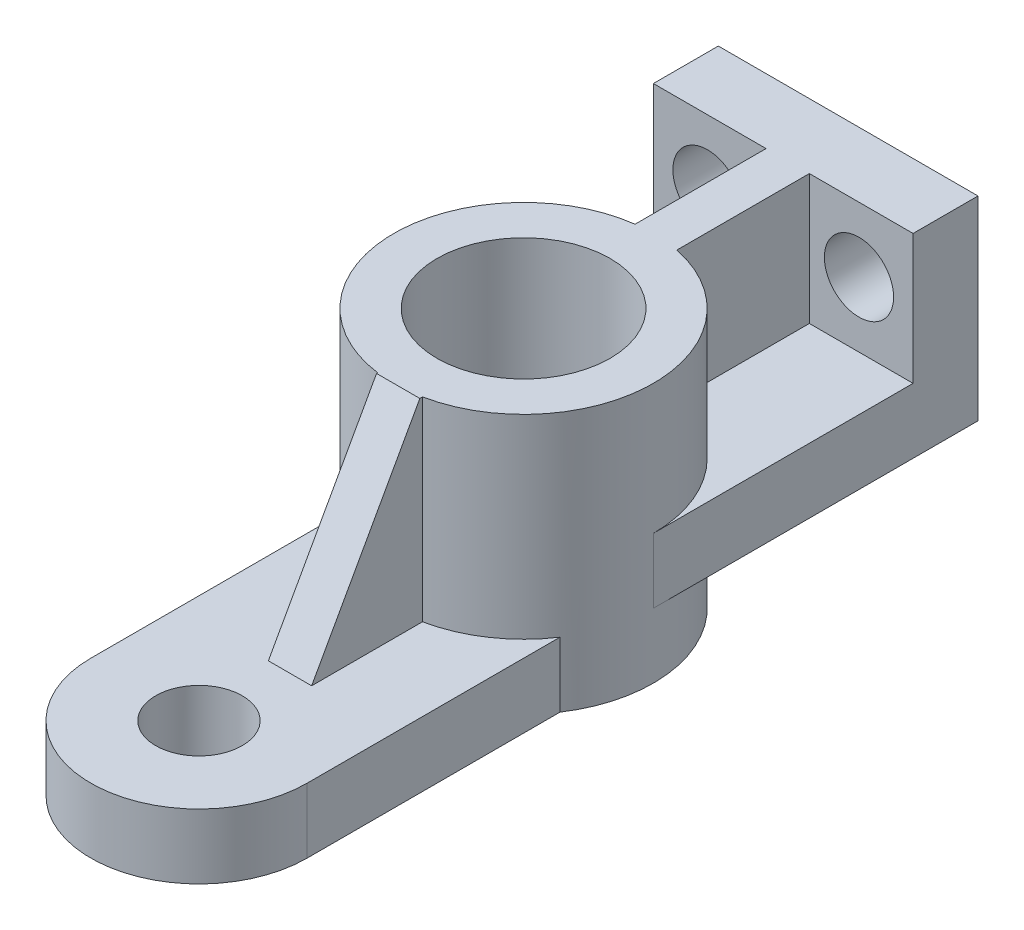
from build123d import *

# Parameters (mm, degrees)
SKETCH1_W               = 1524
SKETCH1_H               = 1143
BOSS_EXTRUDE1_DEPTH     = 381
SKETCH4_R               = 203.2
CUT_EXTRUDE1_DEPTH      = 1943.726434679
SKETCH5_R               = 762
BOSS_EXTRUDE2_DEPTH     = 1524
SKETCH6_W               = 1524
SKETCH6_H               = 381
BOSS_EXTRUDE3_DEPTH     = 1524
SKETCH8_W               = 254
SKETCH8_H               = 787.4
BOSS_EXTRUDE4_DEPTH     = 762
SKETCH10_W              = 1270
SKETCH10_H              = 381
BOSS_EXTRUDE5_DEPTH     = 1905
SKETCH11_R              = 635
BOSS_EXTRUDE6_DEPTH     = 381
CUT_EXTRUDE2_DEPTH      = 4837.015922224
CUT_EXTRUDE2_DEPTH_BACK = 4837.015922224
SKETCH12_R              = 254
BOSS_EXTRUDE10_DEPTH    = 254
SKETCH14_W              = 254
SKETCH14_H              = 1143
BOSS_EXTRUDE11_DEPTH    = 25.4
CUT_EXTRUDE3_DEPTH      = 4940.957186049
CUT_EXTRUDE3_DEPTH_BACK = 4940.957186049
SKETCH15_R              = 508


with BuildPart() as part:
    # Sketch1 → Boss-Extrude1 (new body)
    with BuildSketch(Plane.XY):
        with Locations((-762, 571.5)):
            Rectangle(SKETCH1_W, SKETCH1_H)
    extrude(amount=BOSS_EXTRUDE1_DEPTH)

    # Sketch4 → Cut-Extrude1 (cut, through all)
    with BuildSketch(Plane.XY.offset(381)):
        with Locations((-317.5, 762)):
            Circle(SKETCH4_R)
        with Locations((-1206.5, 762)):
            Circle(SKETCH4_R)
    extrude(amount=-CUT_EXTRUDE1_DEPTH, mode=Mode.SUBTRACT)



with BuildPart() as body_2:
    # Sketch5 → Boss-Extrude2 (new body)
    with BuildSketch(Plane(origin=(0, 1143, 0), x_dir=(1, 0, 0), z_dir=(0, 1, 0))):
        with Locations(Location((-762, -1905, 0), (0, 0, 180))):
            Circle(SKETCH5_R)
    extrude(amount=-BOSS_EXTRUDE2_DEPTH)


with BuildPart() as part_1:
    add(part.part)

    add(body_2.part)  # Boss-Extrude3 merges body 2
    # Sketch6 → Boss-Extrude3 (add)
    with BuildSketch(Plane.XY.offset(381)):
        with Locations((-762, 190.5)):
            Rectangle(SKETCH6_W, SKETCH6_H)
    extrude(amount=BOSS_EXTRUDE3_DEPTH)

    # Sketch8 → Boss-Extrude4 (add)
    with BuildSketch(Plane(origin=(0, 381, 0), x_dir=(1, 0, 0), z_dir=(0, 1, 0))):
        with Locations((-735.723112529, -774.7)):
            Rectangle(SKETCH8_W, SKETCH8_H)
    extrude(amount=BOSS_EXTRUDE4_DEPTH)

    # Sketch10 → Boss-Extrude5 (add)
    with BuildSketch(Plane.XY.offset(1905)):
        with Locations((-762, -190.5)):
            Rectangle(SKETCH10_W, SKETCH10_H)
    extrude(amount=BOSS_EXTRUDE5_DEPTH)

    # Sketch11 → Boss-Extrude6 (add)
    with BuildSketch(Plane(origin=(0, 0, 0), x_dir=(1, 0, 0), z_dir=(0, 1, 0))):
        with Locations((-762, -3810)):
            Circle(SKETCH11_R)
    extrude(amount=-BOSS_EXTRUDE6_DEPTH)

    # Sketch12 → Cut-Extrude2 (cut, two sides: drawn at the far end of the back side and taken through both)
    with BuildSketch(Plane(origin=(0, 0, 0), x_dir=(1, 0, 0), z_dir=(0, 1, 0)).offset(-CUT_EXTRUDE2_DEPTH_BACK)):
        with Locations((-762, -3810)):
            Circle(SKETCH12_R)
    extrude(amount=CUT_EXTRUDE2_DEPTH + CUT_EXTRUDE2_DEPTH_BACK, mode=Mode.SUBTRACT)

    # Sketch13 → Boss-Extrude10 (add)
    with BuildSketch(Plane.ZY.offset(862.723112529)):
        Polygon((2666.9746, 1143), (2666.9746, 0), (3301.9746, 0), align=None)
    extrude(amount=-BOSS_EXTRUDE10_DEPTH)

    # Sketch14 → Boss-Extrude11 (add)
    with BuildSketch(Plane(origin=(0, 0, 2666.9746), x_dir=(-1, 0, 0), z_dir=(0, 0, -1))):
        with Locations((735.723112529, 571.5)):
            Rectangle(SKETCH14_W, SKETCH14_H)
    extrude(amount=BOSS_EXTRUDE11_DEPTH)

    # Sketch15 → Cut-Extrude3 (cut, two sides: drawn at the far end of the back side and taken through both)
    with BuildSketch(Plane(origin=(0, 1143, 0), x_dir=(1, 0, 0), z_dir=(0, 1, 0)).offset(-CUT_EXTRUDE3_DEPTH_BACK)):
        with Locations(Location((-762, -1905, 0), (0, 0, 180))):
            Circle(SKETCH15_R)
    extrude(amount=CUT_EXTRUDE3_DEPTH + CUT_EXTRUDE3_DEPTH_BACK, mode=Mode.SUBTRACT)


solid = part_1.part
